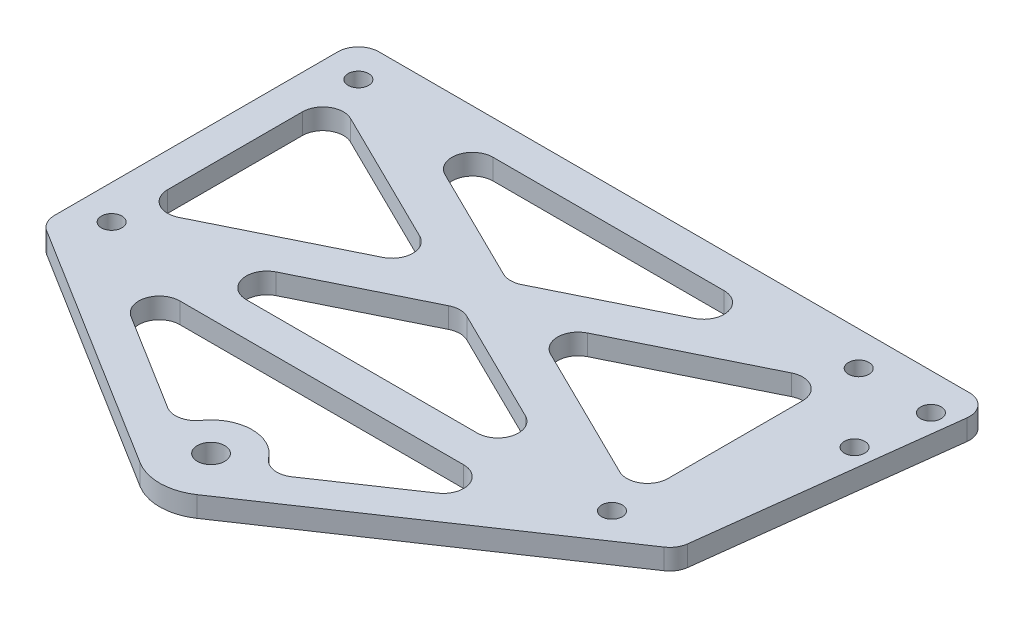
from build123d import *

# Parameters (mm, degrees)
SKETCH_1_R      = 1.5
SKETCH_1_R_2    = 2
EXTRUDE_1_DEPTH = 3
FILLET_1_R      = 3


with BuildPart() as part:
    # 草图1 → 凸台-拉伸1 (new body)
    with BuildSketch(Plane(origin=(0, 0, 0), x_dir=(1, 0, 0), z_dir=(0, 1, 0))):
        with BuildLine():
            Line((51.058349832, 23), (-41.5, 23))
            Line((-41.5, 23), (-41.5, -23))
            Line((-41.5, -23), (-3.963622721, -46.367078995))
            ThreePointArc((-3.963622721, -46.367078995), (0.137420172, -47.498740941), (4.194246234, -46.217579797))
            Line((4.194246234, -46.217579797), (46.024182835, -18))
            Line((46.024182835, -18), (51.058349832, 23))
        make_face()
        with Locations(Location((-36.5, 18, 0), (0, 0, 270))):
            Circle(SKETCH_1_R, mode=Mode.SUBTRACT)
        with Locations(Location((36.5, 18, 0), (0, 0, 270))):
            Circle(SKETCH_1_R, mode=Mode.SUBTRACT)
        with Locations(Location((36.5, -18, 0), (0, 0, 270))):
            Circle(SKETCH_1_R, mode=Mode.SUBTRACT)
        with Locations(Location((-36.5, -18, 0), (0, 0, 270))):
            Circle(SKETCH_1_R, mode=Mode.SUBTRACT)
        with Locations(Location((0, -40, 0), (0, 0, 270))):
            Circle(SKETCH_1_R_2, mode=Mode.SUBTRACT)
        with Locations(Location((46.160921266, 7.730172301, 0), (0, 0, 270))):
            Circle(SKETCH_1_R, mode=Mode.SUBTRACT)
        with Locations(Location((47.3796147, 17.655633817, 0), (0, 0, 270))):
            Circle(SKETCH_1_R, mode=Mode.SUBTRACT)
        Polygon((-29.717158085, 18), (29.717158085, 18), (0, 3.344963136), align=None, mode=Mode.SUBTRACT)
        Polygon((-36.5, 14.655036864), (-36.5, -14.655036864), (-6.782841915, 0), align=None, mode=Mode.SUBTRACT)
        Polygon((29.717158085, -18), (0, -3.344963136), (-29.717158085, -18), align=None, mode=Mode.SUBTRACT)
        Polygon((36.5, -14.655036864), (6.782841915, 0), (36.5, 14.655036864), align=None, mode=Mode.SUBTRACT)
        with BuildLine():
            Line((-32.038958261, -23), (29.671328196, -23))
            Line((29.671328196, -23), (5.919801281, -39.022271619))
            ThreePointArc((5.919801281, -39.022271619), (-0.109936138, -34.001007247), (-5.951649691, -39.239825052))
            Line((-5.951649691, -39.239825052), (-32.038958261, -23))
        make_face(mode=Mode.SUBTRACT)
    extrude(amount=EXTRUDE_1_DEPTH)

    # 圆角1
    fillet_1_edges = [part.edges().sort_by_distance(p)[0] for p in [
        (-41.5, 1.5, 23),
        (-41.5, 1.5, -23),
        (51.058349832, 1.5, -23),
        (46.024182835, 1.5, 18),
        (-32.038958261, 1.5, 23),
        (-5.951649691, 1.5, 39.239825052),
        (5.919801281, 1.5, 39.022271619),
        (29.671328196, 1.5, 23),
        (-29.717158085, 1.5, -18),
        (0, 1.5, -3.344963136),
        (29.717158085, 1.5, -18),
        (-6.782841915, 1.5, 0),
        (-36.5, 1.5, -14.655036864),
        (-36.5, 1.5, 14.655036864),
        (-29.717158085, 1.5, 18),
        (29.717158085, 1.5, 18),
        (0, 1.5, 3.344963136),
        (36.5, 1.5, 14.655036864),
        (36.5, 1.5, -14.655036864),
        (6.782841915, 1.5, 0),
    ]]
    fillet(fillet_1_edges, radius=FILLET_1_R)


solid = part.part
